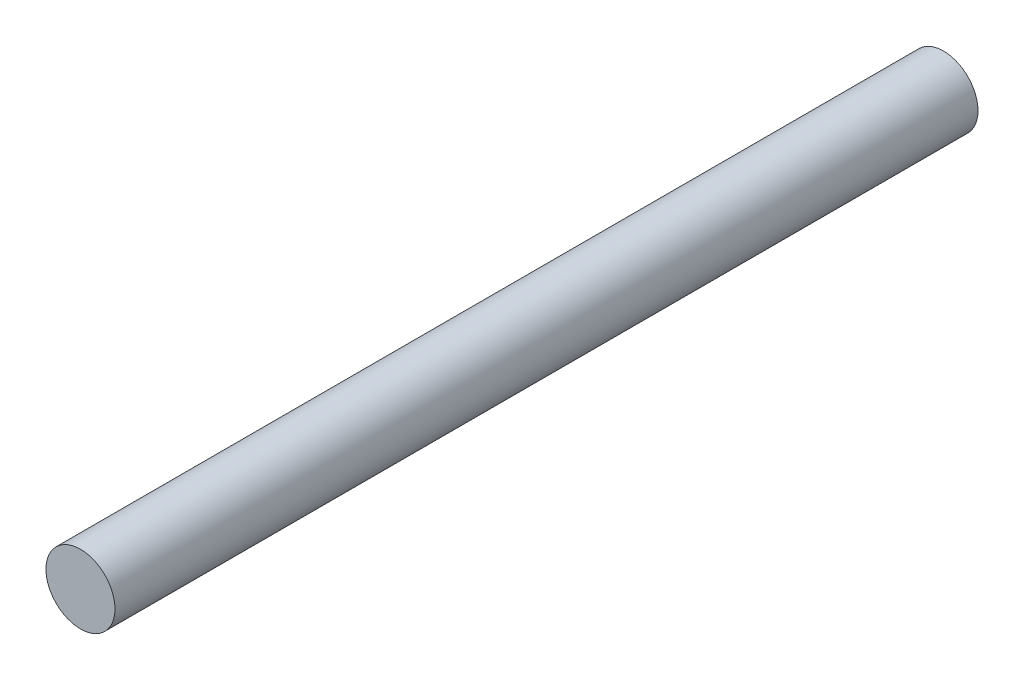
from build123d import *

# Parameters (mm, degrees)
SKIZZE1_R                       = 4
AUFSATZ_LINEAR_AUSTRAGEN1_DEPTH = 50


with BuildPart() as part:
    # Skizze1 → Aufsatz-Linear austragen1 (new, symmetric)
    with BuildSketch(Plane.XY):
        Circle(SKIZZE1_R)
    extrude(amount=AUFSATZ_LINEAR_AUSTRAGEN1_DEPTH, both=True)


solid = part.part
